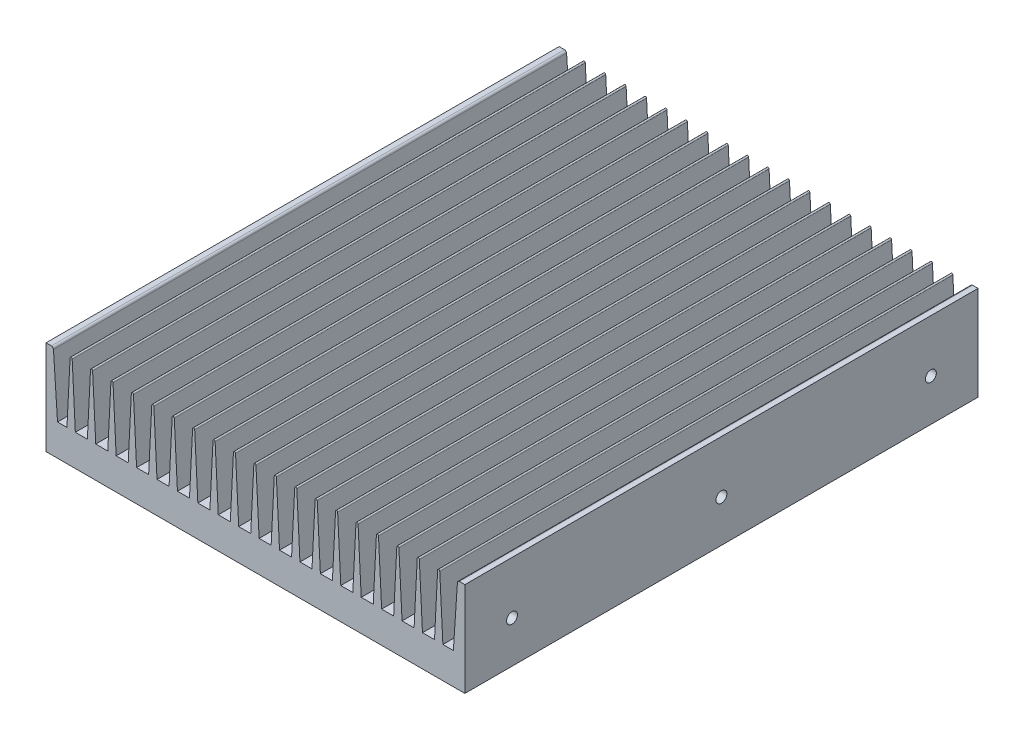
from build123d import *

# Parameters (mm, degrees)
EXTRUDE_1_DEPTH       = 245
EXTRUDE_3_DEPTH       = 245
PATTERN_CURVE_1_COUNT = 19
PATTERN_CURVE_1_PITCH = 9.75
SKETCH_6_R            = 2.5
CUT_EXTRUDE_3_DEPTH   = 8
SKETCH_7_R            = 2.6
CUT_EXTRUDE_4_DEPTH   = 6
SKETCH_8_R            = 4.5
SKETCH_8_R_2          = 3.4
CUT_EXTRUDE_5_DEPTH   = 6
CUT_EXTRUDE_START     = -6
SKETCH_9_R            = 2.6
CUT_EXTRUDE_6_DEPTH   = 6
EXTRUDE_4_REACH       = 321.453
SKETCH_11_R           = 2.6
EXTRUDE_5_REACH       = 321.453
SKETCH_12_R           = 4.5
SKETCH_12_R_2         = 3.4
SKETCH_19_R           = 2.6
CUT_EXTRUDE_12_DEPTH  = 8
SKETCH_21_R           = 2.6
SKETCH_21_R_2         = 1.6
SKETCH_21_R_3         = 1.3
SKETCH_21_R_4         = 2.1
CUT_EXTRUDE_13_DEPTH  = 10


with BuildPart() as part:
    # Эскиз1 → Вытянуть1 (new body)
    with BuildSketch(Plane.XY):
        with BuildLine():
            Line((0, 45), (2.564446908, 45))
            ThreePointArc((2.564446908, 45), (3.247630994, 44.730246195), (3.562232066, 44.066519011))
            Line((3.562232066, 44.066519011), (5.5, 15))
            Line((5.5, 15), (194.5, 15))
            Line((194.5, 15), (196.437767934, 44.066519011))
            ThreePointArc((196.437767934, 44.066519011), (196.752369006, 44.730246195), (197.435553092, 45))
            Line((197.435553092, 45), (200, 45))
            Line((200, 45), (200, 0))
            Line((200, 0), (0, 0))
            Line((0, 0), (0, 45))
        make_face()
    extrude(amount=EXTRUDE_1_DEPTH)

    # Эскиз2 → Вытянуть3 (add)
    with BuildSketch(Plane.XY.offset(245)):
        with BuildLine():
            Line((11.5, 44.5), (10, 15))
            Line((10, 15), (14, 15))
            Line((14, 15), (12.5, 44.5))
            ThreePointArc((12.5, 44.5), (12, 45), (11.5, 44.5))
        make_face()
    extrude_3 = extrude(amount=-EXTRUDE_3_DEPTH)

    # Кривая1: Вытянуть3 ×19
    with Locations(*[(i * PATTERN_CURVE_1_PITCH, 0, 0) for i in range(1, PATTERN_CURVE_1_COUNT)]):
        add(extrude_3)

    # Эскиз6 → Вырез-Вытянуть3 (cut)
    with BuildSketch(Plane(origin=(0, 0, 0), x_dir=(-1, 0, 0), z_dir=(0, 0, -1))):
        with Locations((-4, 6)):
            Circle(SKETCH_6_R)
        with Locations(Location((-196, 6, 0), (0, 0, 180))):
            Circle(SKETCH_6_R)
    extrude(amount=-CUT_EXTRUDE_3_DEPTH, mode=Mode.SUBTRACT)

    # Эскиз7 → Вырез-Вытянуть4 (cut)
    with BuildSketch(Plane.ZY):
        with Locations(Location((22.5, 20, 0), (0, 0, 270))):
            Circle(SKETCH_7_R)
        with Locations(Location((222.5, 20, 0), (0, 0, 270))):
            Circle(SKETCH_7_R)
        with Locations(Location((122.5, 20, 0), (0, 0, 270))):
            Circle(SKETCH_7_R)
    extrude(amount=-CUT_EXTRUDE_4_DEPTH, mode=Mode.SUBTRACT)

    # Эскиз8 → Вырез-Вытянуть5 (cut)
    with BuildSketch(Plane(origin=(200, 0, 0), x_dir=(0, 0, -1), z_dir=(1, 0, 0))):
        with Locations((-80, 30)):
            Circle(SKETCH_8_R)
        with Locations((-165, 30)):
            Circle(SKETCH_8_R_2)
    extrude(amount=-CUT_EXTRUDE_5_DEPTH, mode=Mode.SUBTRACT)

    # Эскиз9 → Вырез-Вытянуть6 (cut)
    with BuildSketch(Plane(origin=(200, 0, 0), x_dir=(0, 0, -1), z_dir=(1, 0, 0)).offset(CUT_EXTRUDE_START)):
        with Locations(Location((-22.5, 20, 0), (0, 0, 270))):
            Circle(SKETCH_9_R)
        with Locations(Location((-122.5, 20, 0), (0, 0, 270))):
            Circle(SKETCH_9_R)
        with Locations(Location((-222.5, 20, 0), (0, 0, 270))):
            Circle(SKETCH_9_R)
    extrude(amount=CUT_EXTRUDE_6_DEPTH, mode=Mode.SUBTRACT)

    # Вытянуть4: up to this face of the body (flat: up to its plane)
    extrude_4_end = Plane(part.part.faces().sort_by_distance((4.525378677, 29.61931985, 122.5))[0])
    # Эскиз11 → Вытянуть4 (add, up to the picked face)
    with BuildSketch(Plane.ZY, mode=Mode.PRIVATE) as extrude_4_sk1:
        with Locations(Location((22.5, 20, 0), (0, 0, 180))):
            Circle(SKETCH_11_R)
    extrude_4_tool1 = split(extrude(extrude_4_sk1.sketch, amount=-EXTRUDE_4_REACH, mode=Mode.PRIVATE), bisect_by=extrude_4_end, keep=Keep.BOTH, mode=Mode.PRIVATE)
    # Эскиз11 → Вытянуть4 (add, up to the picked face)
    with BuildSketch(Plane.ZY, mode=Mode.PRIVATE) as extrude_4_sk2:
        with Locations(Location((122.5, 20, 0), (0, 0, 180))):
            Circle(SKETCH_11_R)
    extrude_4_tool2 = split(extrude(extrude_4_sk2.sketch, amount=-EXTRUDE_4_REACH, mode=Mode.PRIVATE), bisect_by=extrude_4_end, keep=Keep.BOTH, mode=Mode.PRIVATE)
    # Эскиз11 → Вытянуть4 (add, up to the picked face)
    with BuildSketch(Plane.ZY, mode=Mode.PRIVATE) as extrude_4_sk3:
        with Locations(Location((222.5, 20, 0), (0, 0, 180))):
            Circle(SKETCH_11_R)
    extrude_4_tool3 = split(extrude(extrude_4_sk3.sketch, amount=-EXTRUDE_4_REACH, mode=Mode.PRIVATE), bisect_by=extrude_4_end, keep=Keep.BOTH, mode=Mode.PRIVATE)
    add(extrude_4_tool1.solids().sort_by(Axis((0, 20, 22.5), (1, 0, 0)))[0])
    add(extrude_4_tool2.solids().sort_by(Axis((0, 20, 122.5), (1, 0, 0)))[0])
    add(extrude_4_tool3.solids().sort_by(Axis((0, 20, 222.5), (1, 0, 0)))[0])

    # Вытянуть5: up to this face of the body (flat: up to its plane)
    extrude_5_end = Plane(part.part.faces().sort_by_distance((195.474256805, 29.613852069, 122.666761542))[0])
    # Эскиз12 → Вытянуть5 (add, up to the picked face)
    with BuildSketch(Plane(origin=(200, 0, 0), x_dir=(0, 0, -1), z_dir=(1, 0, 0)), mode=Mode.PRIVATE) as extrude_5_sk1:
        with Locations((-80, 30)):
            Circle(SKETCH_12_R)
    extrude_5_tool1 = split(extrude(extrude_5_sk1.sketch, amount=-EXTRUDE_5_REACH, mode=Mode.PRIVATE), bisect_by=extrude_5_end, keep=Keep.BOTH, mode=Mode.PRIVATE)
    # Эскиз12 → Вытянуть5 (add, up to the picked face)
    with BuildSketch(Plane(origin=(200, 0, 0), x_dir=(0, 0, -1), z_dir=(1, 0, 0)), mode=Mode.PRIVATE) as extrude_5_sk2:
        with Locations((-165, 30)):
            Circle(SKETCH_12_R_2)
    extrude_5_tool2 = split(extrude(extrude_5_sk2.sketch, amount=-EXTRUDE_5_REACH, mode=Mode.PRIVATE), bisect_by=extrude_5_end, keep=Keep.BOTH, mode=Mode.PRIVATE)
    add(extrude_5_tool1.solids().sort_by(Axis((200, 30, 80), (-1, 0, 0)))[0])
    add(extrude_5_tool2.solids().sort_by(Axis((200, 30, 165), (-1, 0, 0)))[0])

    # Эскиз19 → Вырез-Вытянуть12 (cut)
    with BuildSketch(Plane.ZY):
        with Locations(Location((222.5, 20, 0), (0, 0, 180))):
            Circle(SKETCH_19_R)
        with Locations(Location((122.5, 20, 0), (0, 0, 180))):
            Circle(SKETCH_19_R)
        with Locations(Location((22.5, 20, 0), (0, 0, 180))):
            Circle(SKETCH_19_R)
    extrude(amount=-CUT_EXTRUDE_12_DEPTH, mode=Mode.SUBTRACT)

    # Эскиз21 → Вырез-Вытянуть13 (cut)
    with BuildSketch(Plane.XZ):
        with Locations((118, 96.5)):
            Circle(SKETCH_21_R)
        with Locations((45, 165)):
            Circle(SKETCH_21_R_2)
        with Locations((45, 15)):
            Circle(SKETCH_21_R_2)
        with Locations((155, 15)):
            Circle(SKETCH_21_R_2)
        with Locations((155, 165)):
            Circle(SKETCH_21_R_2)
        with Locations((78, 74.5)):
            Circle(SKETCH_21_R_3)
        with Locations((123, 74.5)):
            Circle(SKETCH_21_R_3)
        with Locations((78, 45)):
            Circle(SKETCH_21_R_3)
        with Locations((123, 45)):
            Circle(SKETCH_21_R_3)
        with Locations((122.5, 129.25)):
            Circle(SKETCH_21_R_3)
        with Locations((98, 235)):
            Circle(SKETCH_21_R_4)
        with Locations((145, 100)):
            Circle(SKETCH_21_R_4)
        with Locations((98, 180)):
            Circle(SKETCH_21_R_4)
    extrude(amount=-CUT_EXTRUDE_13_DEPTH, mode=Mode.SUBTRACT)


solid = part.part
